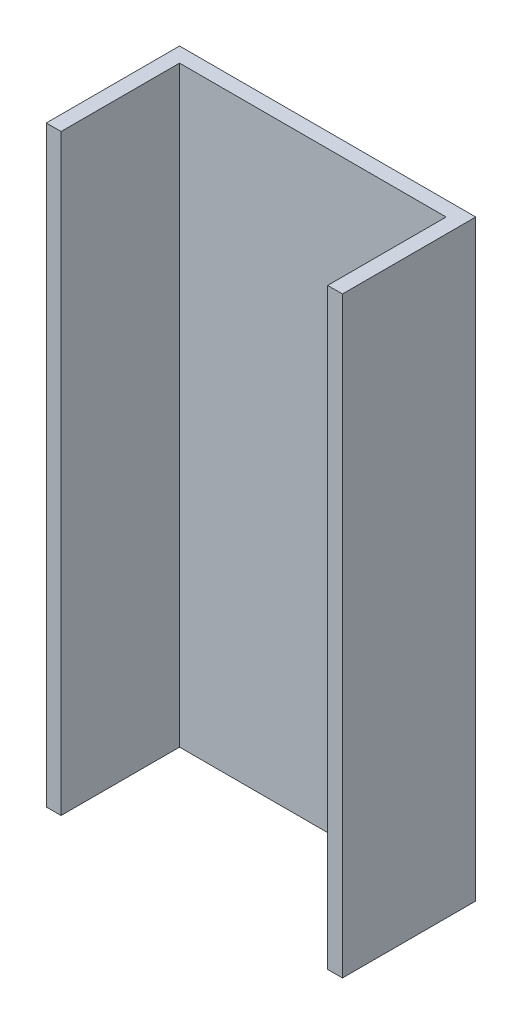
from build123d import *

# Parameters (mm, degrees)
EXTRUDE_1_DEPTH = 4000


with BuildPart() as part:
    # 草图1 → 凸台-拉伸1 (new body)
    with BuildSketch(Plane(origin=(0, 0, 0), x_dir=(1, 0, 0), z_dir=(0, 1, 0))):
        Polygon((-1000, -400), (-1000, 500), (1000, 500), (1000, -400), (900, -400), (900, 400), (-900, 400), (-900, -400), align=None)
    extrude(amount=EXTRUDE_1_DEPTH)


solid = part.part
